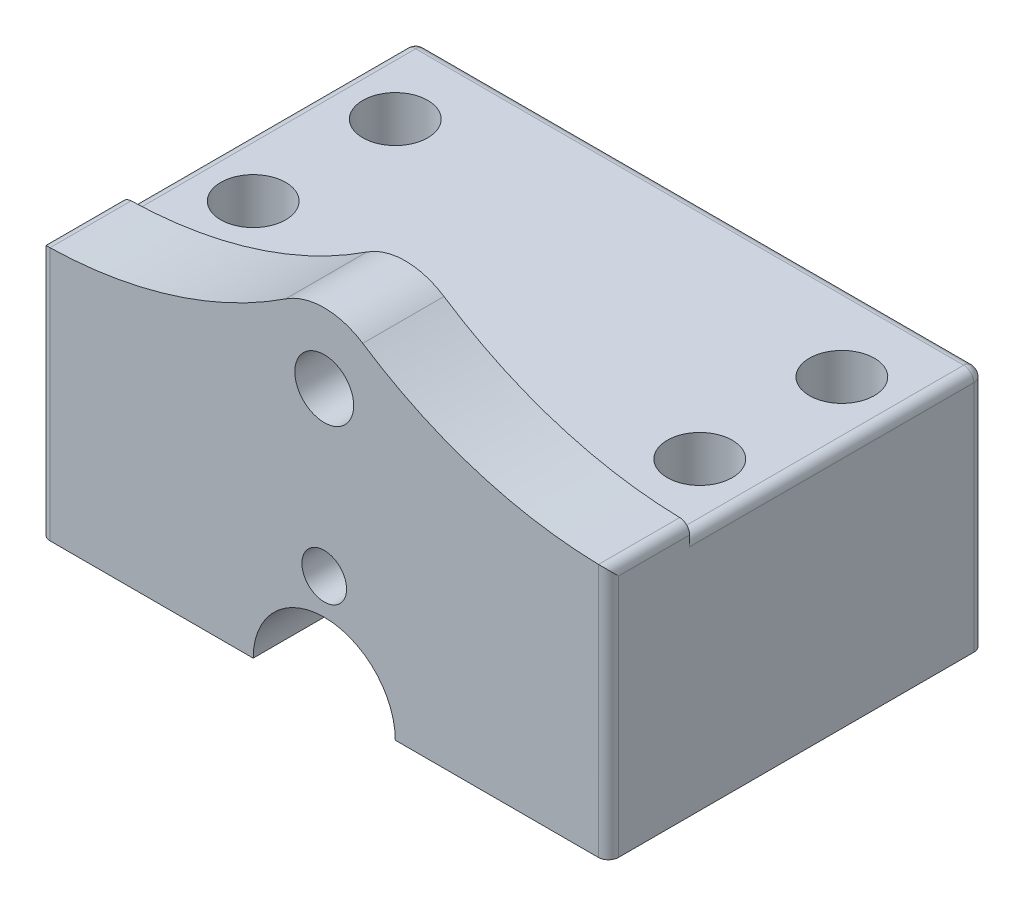
from build123d import *

# Parameters (mm, degrees)
BOSS_EXTRUDE1_DEPTH  = 15
M3_CLEARANCE_HOLE1_D = 3.2
BOSS_EXTRUDE2_DEPTH  = 3.5
M2_CLEARANCE_HOLE2_D = 2.2
SKETCH8_R            = 1.45
BOSS_EXTRUDE3_DEPTH  = 4
SKETCH8_3_R          = 1.45
CUT_EXTRUDE1_DEPTH   = 3
FILLET3_R            = 0.5
SKETCH11_R           = 8.1
CUT_EXTRUDE3_DEPTH   = 15


with BuildPart() as part:
    # Sketch1 → Boss-Extrude1 (new body)
    with BuildSketch(Plane.XY):
        with BuildLine():
            Line((-8, 0), (-14, 0))
            Line((-14, 0), (-14, 12))
            Line((-14, 12), (14, 12))
            Line((14, 12), (14, 0))
            Line((14, 0), (8, 0))
            ThreePointArc((8, 0), (0, 8), (-8, 0))
        make_face()
    extrude(amount=-BOSS_EXTRUDE1_DEPTH)

    # M3 Clearance Hole1 (through all)
    with Locations(Plane(origin=(0, 0, 0), x_dir=(-1, 0, 0), z_dir=(0, -1, 0))):
        with Locations((11, 11), (11, 4), (-11, 11), (-11, 4)):
            Hole(M3_CLEARANCE_HOLE1_D / 2)

    # Sketch5 → Boss-Extrude2 (add)
    with BuildSketch(Plane.XY):
        with BuildLine():
            Line((-3.5, 0), (-14, 0))
            Line((-14, 0), (-14, 12))
            Line((-14, 12), (14, 12))
            Line((14, 12), (14, 0))
            Line((14, 0), (3.5, 0))
            ThreePointArc((3.5, 0), (0, 3.5), (-3.5, 0))
        make_face()
    extrude(amount=BOSS_EXTRUDE2_DEPTH)

    # M2 Clearance Hole2 (through all)
    with Locations(Plane.XY.offset(3.5)):
        with Locations((0, 5.25)):
            Hole(M2_CLEARANCE_HOLE2_D / 2)

    # Sketch8 → Boss-Extrude3 (add)
    with BuildSketch(Plane.XY.offset(3.5)):
        with BuildLine():
            Line((-14, 12.5), (-14, 12))
            Line((-14, 12), (-0.734846923, 12))
            ThreePointArc((-0.734846923, 12), (-0.720059707, 14.508576187), (1.45, 13.25))
            ThreePointArc((1.45, 13.25), (1.258576187, 12.529940293), (0.734846923, 12))
            Line((0.734846923, 12), (14, 12))
            Line((14, 12), (14, 12.5))
            ThreePointArc((14, 12.5), (7.683135649, 13.42711883), (1.899082569, 16.130275229))
            ThreePointArc((1.899082569, 16.130275229), (0, 16.7), (-1.899082569, 16.130275229))
            ThreePointArc((-1.899082569, 16.130275229), (-7.683135649, 13.42711883), (-14, 12.5))
        make_face()
        with Locations((0, 13.25)):
            Circle(SKETCH8_R)
    extrude(amount=-BOSS_EXTRUDE3_DEPTH)

    # Sketch8<3> → Cut-Extrude1 (cut)
    with BuildSketch(Plane.XY.offset(3.5)):
        with Locations((0, 13.25)):
            Circle(SKETCH8_3_R)
        with BuildLine():
            ThreePointArc((1.45, 13.25), (-0.720059707, 14.508576187), (-0.734846923, 12))
            Line((-0.734846923, 12), (0.734846923, 12))
            ThreePointArc((0.734846923, 12), (1.258576187, 12.529940293), (1.45, 13.25))
        make_face()
        with BuildLine():
            Line((0.734846923, 12), (-0.734846923, 12))
            ThreePointArc((-0.734846923, 12), (0, 11.8), (0.734846923, 12))
        make_face()
    extrude(amount=-CUT_EXTRUDE1_DEPTH, mode=Mode.SUBTRACT)

    # Fillet3
    fillet3_edges = [part.edges().sort_by_distance(p)[0] for p in [
        (-14, 12, -7.75),
        (14, 12, -7.75),
        (14, 6, -15),
        (0, 12, -15),
        (-14, 6, -15),
        (14, 6.25, 3.5),
        (-14, 6.25, 3.5),
        (14, 12.5, 1.5),
        (-14, 12.5, 1.5),
    ]]
    fillet(fillet3_edges, radius=FILLET3_R)

    # Sketch11 → Cut-Extrude3 (cut)
    with BuildSketch(Plane(origin=(0, 0, -15), x_dir=(-1, 0, 0), z_dir=(0, 0, -1))):
        Circle(SKETCH11_R)
    extrude(amount=-CUT_EXTRUDE3_DEPTH, mode=Mode.SUBTRACT)


solid = part.part
